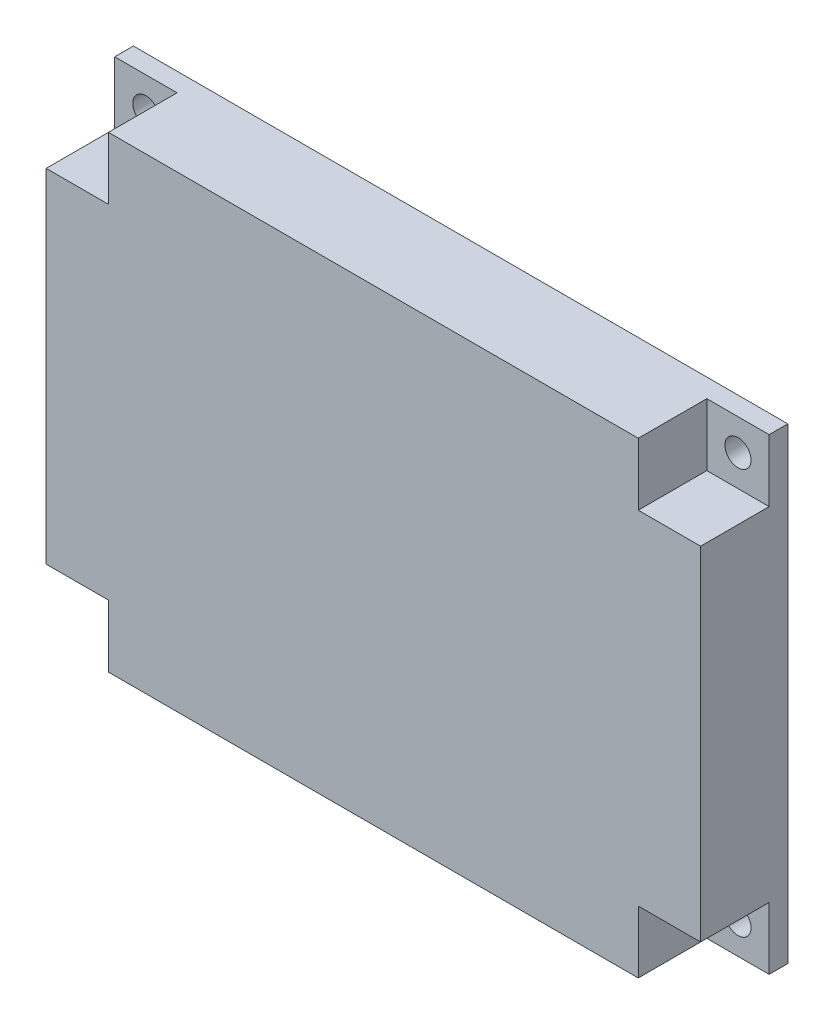
from build123d import *

# Parameters (mm, degrees)
ESQUISSE1_W             = 105
ESQUISSE1_H             = 75
ESQUISSE1_R             = 2.1
BOSS_EXTRU_1_DEPTH      = 14
ESQUISSE3_W             = 10
ESQUISSE3_H             = 10
ENL_V_MAT_EXTRU_1_DEPTH = 11


with BuildPart() as part:
    # Esquisse1 → Boss.-Extru.1 (new body)
    with BuildSketch(Plane.XY):
        Rectangle(ESQUISSE1_W, ESQUISSE1_H)
        with Locations((47.5, 32.5)):
            Circle(ESQUISSE1_R, mode=Mode.SUBTRACT)
        with Locations(Location((-47.5, 32.5, 0), (0, 0, 180))):
            Circle(ESQUISSE1_R, mode=Mode.SUBTRACT)
        with Locations(Location((47.5, -32.5, 0), (0, 0, 180))):
            Circle(ESQUISSE1_R, mode=Mode.SUBTRACT)
        with Locations((-47.5, -32.5)):
            Circle(ESQUISSE1_R, mode=Mode.SUBTRACT)
    extrude(amount=BOSS_EXTRU_1_DEPTH)

    # Esquisse3 → Enlèv. mat.-Extru.1 (cut)
    with BuildSketch(Plane.XY.offset(14)):
        with Locations((47.5, 32.5)):
            Rectangle(ESQUISSE3_W, ESQUISSE3_H)
        with Locations((-47.5, 32.5)):
            Rectangle(ESQUISSE3_W, ESQUISSE3_H)
        with Locations((-47.5, -32.5)):
            Rectangle(ESQUISSE3_W, ESQUISSE3_H)
        with Locations((47.5, -32.5)):
            Rectangle(ESQUISSE3_W, ESQUISSE3_H)
    extrude(amount=-ENL_V_MAT_EXTRU_1_DEPTH, mode=Mode.SUBTRACT)


solid = part.part
